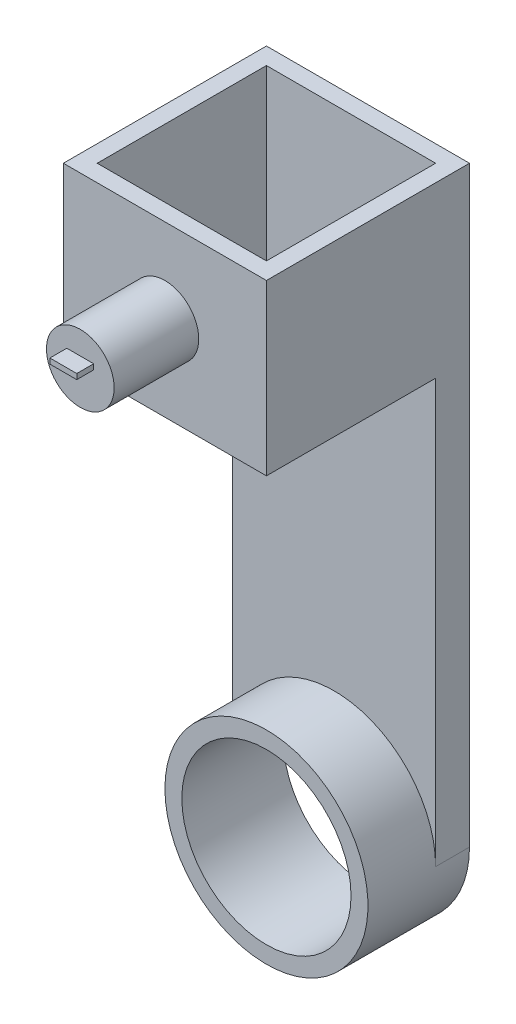
from build123d import *

# Parameters (mm, degrees)
EXTRUDE_1_DEPTH     = 2
SKETCH_4_R          = 6
SKETCH_4_R_2        = 5
EXTRUDE_2_DEPTH     = 6
SKETCH_5_W          = 12
SKETCH_5_H          = 12
EXTRUDE_3_DEPTH     = 10
CUT_EXTRUDE_1_DEPTH = 10
EXTRUDE_4_DEPTH     = 5
SKETCH_9_W          = 1.588517845
SKETCH_9_H          = 0.313853782
EXTRUDE_6_DEPTH     = 1


with BuildPart() as part:
    # 草图1 → 凸台-拉伸1 (new body)
    with BuildSketch(Plane.XY):
        with BuildLine():
            ThreePointArc((-6, 0), (0, 6), (6, 0))
            Line((6, 0), (6, 25))
            Line((6, 25), (-6, 25))
            Line((-6, 25), (-6, 0))
        make_face()
    extrude(amount=EXTRUDE_1_DEPTH)

    # 草图4 → 凸台-拉伸2 (add)
    with BuildSketch(Plane(origin=(0, 0, 0), x_dir=(-1, 0, 0), z_dir=(0, 0, -1))):
        Circle(SKETCH_4_R)
        Circle(SKETCH_4_R_2, mode=Mode.SUBTRACT)
    extrude(amount=-EXTRUDE_2_DEPTH)

    # 草图5 → 凸台-拉伸3 (add)
    with BuildSketch(Plane(origin=(0, 25, 0), x_dir=(1, 0, 0), z_dir=(0, 1, 0))):
        with Locations((0, -6)):
            Rectangle(SKETCH_5_W, SKETCH_5_H)
    extrude(amount=EXTRUDE_3_DEPTH)

    # 草图6 → 切除-拉伸1 (cut)
    with BuildSketch(Plane(origin=(0, 35, 0), x_dir=(1, 0, 0), z_dir=(0, 1, 0))):
        Polygon((5, -1), (-5, -1), (5, -11), align=None)
        Polygon((5, -11), (-5, -1), (-5, -11), align=None)
    extrude(amount=-CUT_EXTRUDE_1_DEPTH, mode=Mode.SUBTRACT)

    # 草图7 → 凸台-拉伸4 (add)
    with BuildSketch(Plane.XY.offset(12)):
        with BuildLine():
            ThreePointArc((2, 30), (0.680850528, 31.880543155), (-1.536442559, 31.280368799))
            Line((-1.536442559, 31.280368799), (1.536442559, 28.719631201))
            ThreePointArc((1.536442559, 28.719631201), (1.880543155, 29.319149472), (2, 30))
        make_face()
        with BuildLine():
            Line((1.536442559, 28.719631201), (-1.536442559, 31.280368799))
            ThreePointArc((-1.536442559, 31.280368799), (-1.280368799, 28.463557441), (1.536442559, 28.719631201))
        make_face()
    extrude(amount=EXTRUDE_4_DEPTH)

    # 草图9 → 凸台-拉伸6 (add)
    with BuildSketch(Plane.XY.offset(17)):
        with Locations((-0.002943276, 30.476616651)):
            Rectangle(SKETCH_9_W, SKETCH_9_H)
    extrude(amount=EXTRUDE_6_DEPTH)


solid = part.part
